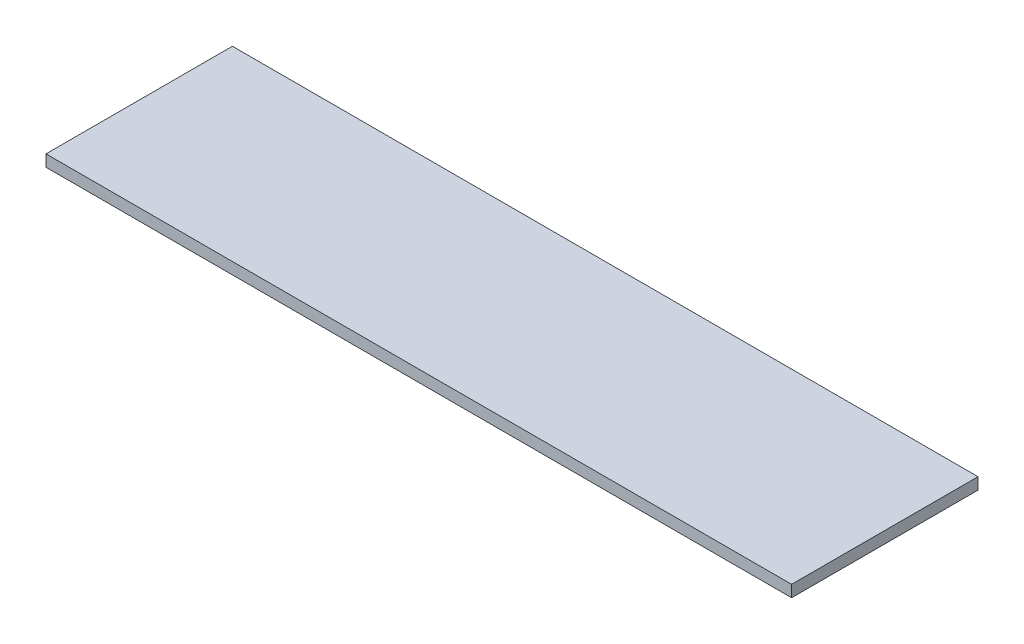
from build123d import *

# Parameters (mm, degrees)
SKETCH1_W           = 1219.2
SKETCH1_H           = 304.8
BOSS_EXTRUDE1_DEPTH = 19.05


with BuildPart() as part:
    # Sketch1 → Boss-Extrude1 (new body)
    with BuildSketch(Plane(origin=(0, 0, 0), x_dir=(1, 0, 0), z_dir=(0, 1, 0))):
        Rectangle(SKETCH1_W, SKETCH1_H)
    extrude(amount=BOSS_EXTRUDE1_DEPTH)


solid = part.part
